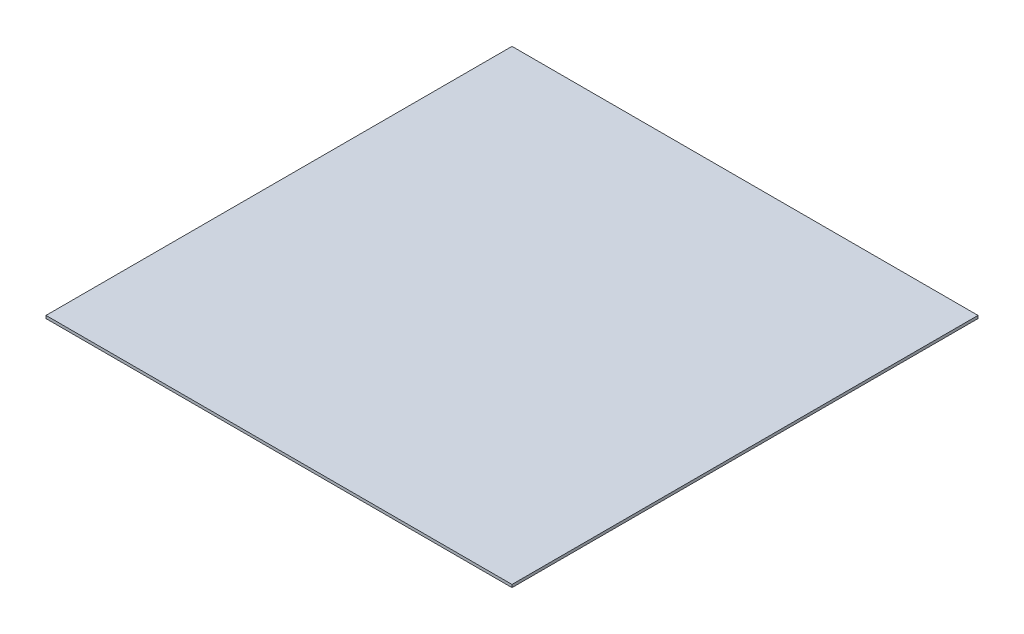
from build123d import *

# Parameters (mm, degrees)
SKETCH1_W           = 300
SKETCH1_H           = 300
BOSS_EXTRUDE1_DEPTH = 1.8


with BuildPart() as part:
    # Sketch1 → Boss-Extrude1 (new body)
    with BuildSketch(Plane(origin=(0, 0, 0), x_dir=(1, 0, 0), z_dir=(0, 1, 0))):
        Rectangle(SKETCH1_W, SKETCH1_H)
    extrude(amount=BOSS_EXTRUDE1_DEPTH)


solid = part.part
